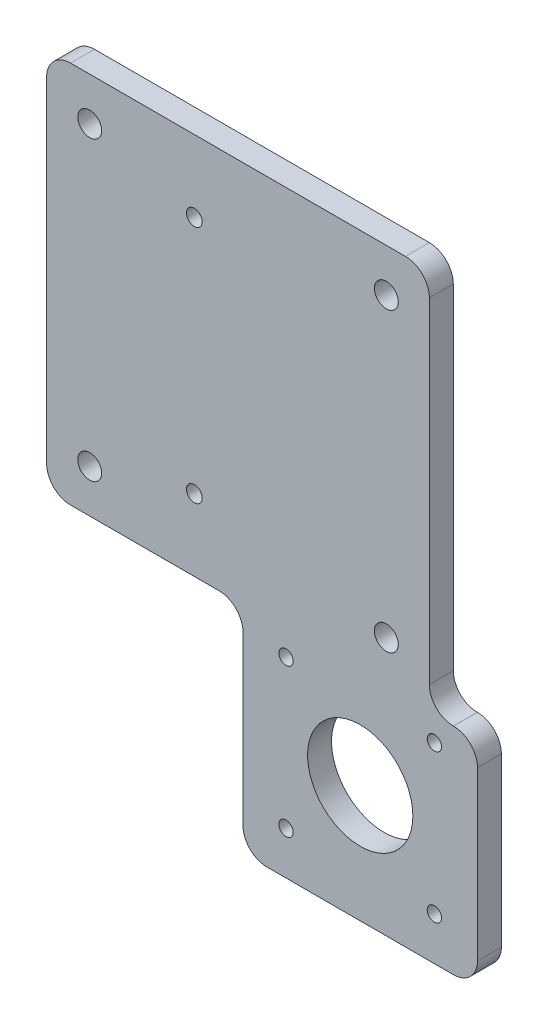
from build123d import *

# Parameters (mm, degrees)
SKETCH1_R           = 2.5
SKETCH1_R_2         = 1.5
SKETCH1_R_3         = 11
SKETCH1_R_4         = 1.65
BOSS_EXTRUDE1_DEPTH = 5
FILLET1_R           = 5


with BuildPart() as part:
    # Sketch1 → Boss-Extrude1 (new body)
    with BuildSketch(Plane.XY):
        Polygon((0, 0), (0, 80), (80, 80), (80, 0), (90.043707679, 0), (90.043707679, -45), (41.043707679, -45), (41.043707679, 0), align=None)
        with Locations((9, 71)):
            Circle(SKETCH1_R, mode=Mode.SUBTRACT)
        with Locations((71, 71)):
            Circle(SKETCH1_R, mode=Mode.SUBTRACT)
        with Locations((71, 9)):
            Circle(SKETCH1_R, mode=Mode.SUBTRACT)
        with Locations((9, 9)):
            Circle(SKETCH1_R, mode=Mode.SUBTRACT)
        with Locations((50.043707679, -5)):
            Circle(SKETCH1_R_2, mode=Mode.SUBTRACT)
        with Locations((81.043707679, -5)):
            Circle(SKETCH1_R_2, mode=Mode.SUBTRACT)
        with Locations((50.043707679, -36)):
            Circle(SKETCH1_R_2, mode=Mode.SUBTRACT)
        with Locations((81.043707679, -36)):
            Circle(SKETCH1_R_2, mode=Mode.SUBTRACT)
        with Locations((65.543707679, -20.5)):
            Circle(SKETCH1_R_3, mode=Mode.SUBTRACT)
        with Locations((30.868801214, 15)):
            Circle(SKETCH1_R_4, mode=Mode.SUBTRACT)
        with Locations((30.868801214, 65)):
            Circle(SKETCH1_R_4, mode=Mode.SUBTRACT)
    extrude(amount=BOSS_EXTRUDE1_DEPTH)

    # Fillet1
    fillet1_edges = [part.edges().sort_by_distance(p)[0] for p in [
        (0, 0, 2.5),
        (0, 80, 2.5),
        (80, 80, 2.5),
        (80, 0, 2.5),
        (90.043707679, 0, 2.5),
        (90.043707679, -45, 2.5),
        (41.043707679, -45, 2.5),
        (41.043707679, 0, 2.5),
    ]]
    fillet(fillet1_edges, radius=FILLET1_R)


solid = part.part
